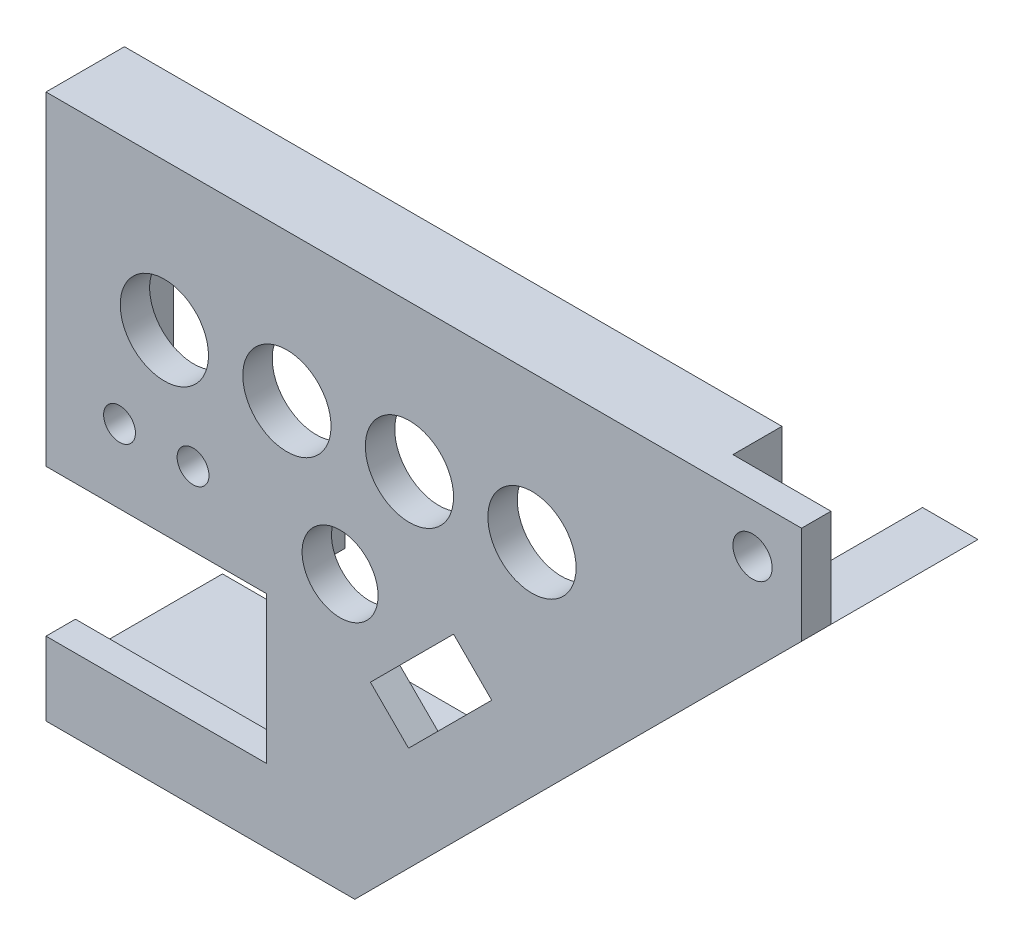
from build123d import *

# Parameters (mm, degrees)
BOSS_EXTRU_1_DEPTH         = 6
ESQUISSE2_R                = 9
ESQUISSE2_R_2              = 7.75
ESQUISSE2_R_3              = 3.25
ENL_V_MAT_EXTRU_1_DEPTH    = 191.138226036
ESQUISSE3_W                = 45
ESQUISSE3_H                = 30
ENL_V_MAT_EXTRU_2_DEPTH    = 191.138226036
BOSS_EXTRU_2_DEPTH         = 30
BOSS_EXTRU_3_DEPTH         = 10
ESQUISSE8_R                = 4
ENL_V_MAT_EXTRU_3_DEPTH    = 194.423227664
ENL_V_MAT_EXTRU_4_REACH    = 194.397
ESQUISSE9_R                = 1.35
R_P_TITION_LIN_AIRE1_COUNT = 3
R_P_TITION_LIN_AIRE1_PITCH = 20
ESQUISSE10_R               = 3
ENL_V_MAT_EXTRU_5_DEPTH    = 10
ESQUISSE11_W               = 63
ESQUISSE11_H               = 10
ENL_V_MAT_EXTRU_6_DEPTH    = 5
ESQUISSE12_W               = 10
ESQUISSE12_H               = 87
ENL_V_MAT_EXTRU_7_DEPTH    = 5


with BuildPart() as part:
    # Esquisse1 → Boss.-Extru.1 (new body)
    with BuildSketch(Plane.XY):
        Polygon((0, 0), (63, 0), (154.15, 91.15), (154.15, 111.15), (0, 111.15), align=None)
    extrude(amount=BOSS_EXTRU_1_DEPTH)

    # Esquisse2 → Enlèv. mat.-Extru.1 (cut, through all)
    with BuildSketch(Plane.XY.offset(6)):
        with Locations((49.149999599, 81.15)):
            Circle(ESQUISSE2_R)
        with Locations((74.15, 81.15)):
            Circle(ESQUISSE2_R)
        with Locations((99.15, 81.15)):
            Circle(ESQUISSE2_R)
        with Locations((24.149999599, 81.15)):
            Circle(ESQUISSE2_R)
        with Locations((60, 56)):
            Circle(ESQUISSE2_R_2)
        with Locations((30, 60)):
            Circle(ESQUISSE2_R_3)
        with Locations((15, 60)):
            Circle(ESQUISSE2_R_3)
        Polygon((66.188059223, 39.957611845), (73.966233816, 32.179437252), (90.936796564, 49.15), (83.158621971, 56.928174593), align=None)
    extrude(amount=-ENL_V_MAT_EXTRU_1_DEPTH, mode=Mode.SUBTRACT)

    # Esquisse3 → Enlèv. mat.-Extru.2 (cut, through all)
    with BuildSketch(Plane.XY.offset(6)):
        with Locations((22.5, 30)):
            Rectangle(ESQUISSE3_W, ESQUISSE3_H)
    extrude(amount=-ENL_V_MAT_EXTRU_2_DEPTH, mode=Mode.SUBTRACT)

    # Esquisse6 → Boss.-Extru.2 (add)
    with BuildSketch(Plane(origin=(0, 0, 0), x_dir=(-1, 0, 0), z_dir=(0, 0, -1))):
        Polygon((-154.15, 91.15), (-142.836291501, 91.15), (-59.686291501, 8), (0, 8), (0, 0), (-63, 0), align=None)
    extrude(amount=BOSS_EXTRU_2_DEPTH)

    # Esquisse7 → Boss.-Extru.3 (add)
    with BuildSketch(Plane(origin=(0, 0, 0), x_dir=(-1, 0, 0), z_dir=(0, 0, -1))):
        Polygon((-10, 55), (-45, 55), (-45, 45), (0, 45), (0, 111.15), (-134.15, 111.15), (-134.15, 91.15), (-142.836291501, 91.15), (-128.15, 76.463708499), (-128.15, 105.15), (-10, 105.15), align=None)
    extrude(amount=BOSS_EXTRU_3_DEPTH)

    # Esquisse8 → Enlèv. mat.-Extru.3 (cut, through all)
    with BuildSketch(Plane.XY.offset(6)):
        with Locations((144.15, 101.15)):
            Circle(ESQUISSE8_R)
    extrude(amount=-ENL_V_MAT_EXTRU_3_DEPTH, mode=Mode.SUBTRACT)

    # Esquisse9 → Enlèv. mat.-Extru.4 (cut, up to next)
    with BuildSketch(Plane.ZY, mode=Mode.PRIVATE) as enl_v_mat_extru_4_sk1:
        with Locations((-5, 101.15)):
            Circle(ESQUISSE9_R)
    enl_v_mat_extru_4_tool1 = extrude(enl_v_mat_extru_4_sk1.sketch, amount=-ENL_V_MAT_EXTRU_4_REACH, mode=Mode.PRIVATE) & part.part
    enl_v_mat_extru_4 = enl_v_mat_extru_4_tool1.solids().sort_by_distance((0, 101.15, -5))[0]
    add(enl_v_mat_extru_4, mode=Mode.SUBTRACT)

    # Répétition linéaire1: Enlèv. mat.-Extru.4 ×3
    with Locations(*[(0, -i * R_P_TITION_LIN_AIRE1_PITCH, 0) for i in range(1, R_P_TITION_LIN_AIRE1_COUNT)]):
        add(enl_v_mat_extru_4, mode=Mode.SUBTRACT)

    # Esquisse10 → Enlèv. mat.-Extru.5 (cut)
    with BuildSketch(Plane.ZY):
        with Locations((0, 91.15)):
            Circle(ESQUISSE10_R)
        with Locations((0, 71.15)):
            Circle(ESQUISSE10_R)
        with Locations((0, 51.15)):
            Circle(ESQUISSE10_R)
        with Locations((-14, 4)):
            Circle(ESQUISSE10_R)
        with Locations((0, 4)):
            Circle(ESQUISSE10_R)
    extrude(amount=-ENL_V_MAT_EXTRU_5_DEPTH, mode=Mode.SUBTRACT)

    # Esquisse11 → Enlèv. mat.-Extru.6 (cut)
    with BuildSketch(Plane.XZ):
        with Locations((31.5, -25)):
            Rectangle(ESQUISSE11_W, ESQUISSE11_H)
    extrude(amount=-ENL_V_MAT_EXTRU_6_DEPTH, mode=Mode.SUBTRACT)

    # Esquisse12 → Enlèv. mat.-Extru.7 (cut)
    with BuildSketch(Plane(origin=(31.5, -31.5, 0), x_dir=(0, 0, -1), z_dir=(0.7071067811865489, -0.7071067811865462, 0))):
        with Locations((25, 109.00051032)):
            Rectangle(ESQUISSE12_W, ESQUISSE12_H)
    extrude(amount=-ENL_V_MAT_EXTRU_7_DEPTH, mode=Mode.SUBTRACT)


solid = part.part
